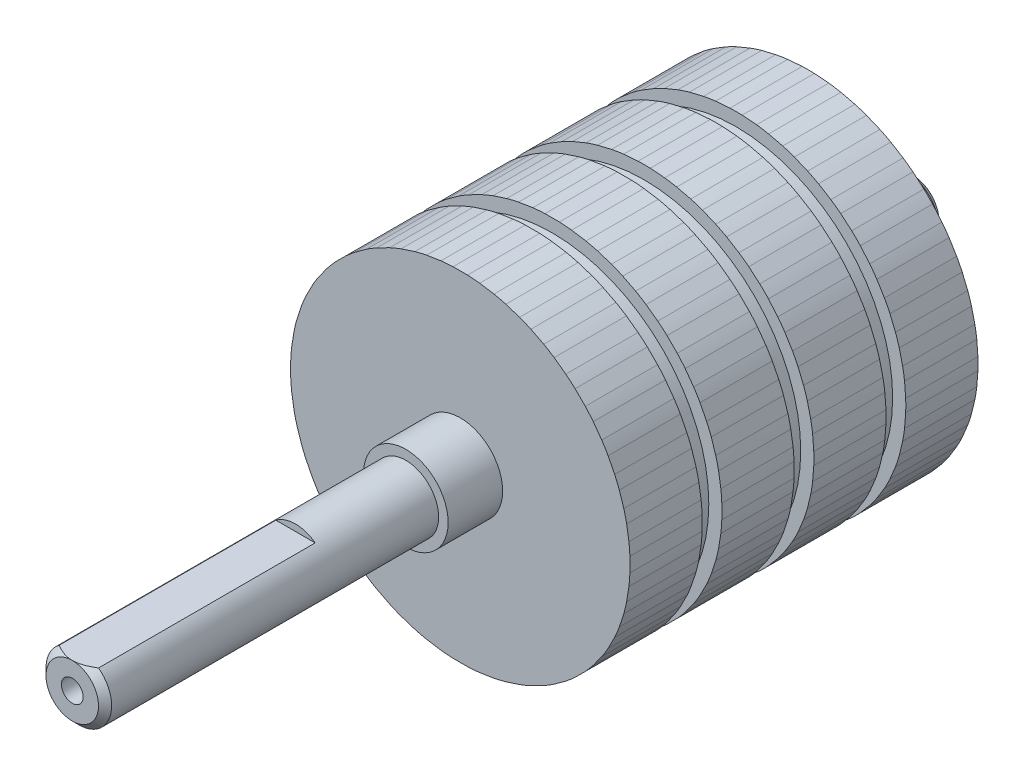
from build123d import *

# Parameters (mm, degrees)
SKETCH2_OUTSIDE_W  = 42.592
SKETCH2_OUTSIDE_H  = 42.592
CUT_EXTRUDE1_DEPTH = 12.5
SKETCH3_OUTSIDE_W  = 42.592
SKETCH3_OUTSIDE_H  = 42.592
CUT_EXTRUDE2_DEPTH = 12.5
SKETCH4_W          = 5
SKETCH4_H          = 1
CUT_EXTRUDE3_DEPTH = 17


with BuildPart() as part:
    # Sketch1 → Revolve1 (revolve)
    with BuildSketch(Plane(origin=(0, 0, 0), x_dir=(0, 0, -1), z_dir=(1, 0, 0)), mode=Mode.PRIVATE) as revolve1_sk:
        Polygon((-26.4, -0.825), (-27.9, -0.825), (-27.9, -2), (-27.4, -2.5), (-2.5, -2.5), (-2.5, -3.225), (1.65, -3.225), (1.65, -12.925), (2.65, -11.925), (6.15, -11.925), (7.15, -12.925), (7.15, -11.925), (8.65, -11.925), (8.65, -12.925), (9.65, -11.925), (13.15, -11.925), (14.15, -12.925), (14.15, -11.925), (15.65, -11.925), (15.65, -12.925), (16.65, -11.925), (20.15, -11.925), (21.15, -12.925), (21.15, -11.925), (22.65, -11.925), (22.65, -12.925), (23.65, -11.925), (27.15, -11.925), (28.15, -12.925), (28.15, -3.225), (31.6, -3.225), (31.6, -2.5), (35.6, -2.5), (36.1, -2), (36.1, -0.875), (34.6, -0.875), (34.6, 0), (-26.4, 0), align=None)
    revolve(revolve1_sk.sketch.rotate(Axis((0, 0, 34.738268814), (0, 0, -1)), 270), axis=Axis((0, 0, 34.738268814), (0, 0, -1)))

    # Sketch1<3> → Revolve2 (revolve)
    with BuildSketch(Plane(origin=(0, 0, 0), x_dir=(0, 0, -1), z_dir=(1, 0, 0)), mode=Mode.PRIVATE) as revolve2_sk:
        Polygon((2.65, -11.925), (1.65, -12.925), (7.15, -12.925), (6.15, -11.925), align=None)
        Polygon((9.65, -11.925), (8.65, -12.925), (14.15, -12.925), (13.15, -11.925), align=None)
        Polygon((22.65, -12.925), (28.15, -12.925), (27.15, -11.925), (23.65, -11.925), align=None)
        Polygon((16.65, -11.925), (15.65, -12.925), (21.15, -12.925), (20.15, -11.925), align=None)
    revolve(revolve2_sk.sketch.rotate(Axis((0, 0, 34.738268814), (0, 0, -1)), 270), axis=Axis((0, 0, 34.738268814), (0, 0, -1)))

    # Sketch2 outside → Cut-Extrude1 (cut)
    with BuildSketch(Plane.XY.offset(-1.65)):
        Rectangle(SKETCH2_OUTSIDE_W, SKETCH2_OUTSIDE_H)
        Polygon((4.956983851, 11.967217641), (3.023869864, 12.59532445), (1.016298166, 12.91329257), (-1.016298166, 12.91329257), (-3.023869864, 12.59532445), (-4.956983851, 11.967217641), (-6.768040444, 11.044438216), (-8.412445419, 9.849708069), (-9.849708069, 8.412445419), (-11.044438216, 6.768040444), (-11.967217641, 4.956983851), (-12.59532445, 3.023869864), (-12.91329257, 1.016298166), (-12.91329257, -1.016298166), (-12.59532445, -3.023869864), (-11.967217641, -4.956983851), (-11.044438216, -6.768040444), (-9.849708069, -8.412445419), (-8.412445419, -9.849708069), (-6.768040444, -11.044438216), (-4.956983851, -11.967217641), (-3.023869864, -12.59532445), (-1.016298166, -12.91329257), (1.016298166, -12.91329257), (3.023869864, -12.59532445), (4.956983851, -11.967217641), (6.768040444, -11.044438216), (8.412445419, -9.849708069), (9.849708069, -8.412445419), (11.044438216, -6.768040444), (11.967217641, -4.956983851), (12.59532445, -3.023869864), (12.91329257, -1.016298166), (12.91329257, 1.016298166), (12.59532445, 3.023869864), (11.967217641, 4.956983851), (11.044438216, 6.768040444), (9.849708069, 8.412445419), (8.412445419, 9.849708069), (6.768040444, 11.044438216), align=None, mode=Mode.SUBTRACT)
    extrude(amount=-CUT_EXTRUDE1_DEPTH, mode=Mode.SUBTRACT)

    # Sketch3 outside → Cut-Extrude2 (cut)
    with BuildSketch(Plane(origin=(0, 0, -28.15), x_dir=(-1, 0, 0), z_dir=(0, 0, -1))):
        Rectangle(SKETCH3_OUTSIDE_W, SKETCH3_OUTSIDE_H)
        Polygon((0, 12.953223034), (-2.026330516, 12.793747364), (-4.002766049, 12.319247173), (-5.880640198, 11.541406232), (-7.613713469, 10.479377566), (-9.159311845, 9.159311845), (-10.479377566, 7.613713469), (-11.541406232, 5.880640198), (-12.319247173, 4.002766049), (-12.793747364, 2.026330516), (-12.953223034, 0), (-12.793747364, -2.026330516), (-12.319247173, -4.002766049), (-11.541406232, -5.880640198), (-10.479377566, -7.613713469), (-9.159311845, -9.159311845), (-7.613713469, -10.479377566), (-5.880640198, -11.541406232), (-4.002766049, -12.319247173), (-2.026330516, -12.793747364), (0, -12.953223034), (2.026330516, -12.793747364), (4.002766049, -12.319247173), (5.880640198, -11.541406232), (7.613713469, -10.479377566), (9.159311845, -9.159311845), (10.479377566, -7.613713469), (11.541406232, -5.880640198), (12.319247173, -4.002766049), (12.793747364, -2.026330516), (12.953223034, 0), (12.793747364, 2.026330516), (12.319247173, 4.002766049), (11.541406232, 5.880640198), (10.479377566, 7.613713469), (9.159311845, 9.159311845), (7.613713469, 10.479377566), (5.880640198, 11.541406232), (4.002766049, 12.319247173), (2.026330516, 12.793747364), align=None, mode=Mode.SUBTRACT)
    extrude(amount=-CUT_EXTRUDE2_DEPTH, mode=Mode.SUBTRACT)

    # Sketch4 → Cut-Extrude3 (cut)
    with BuildSketch(Plane.XY.offset(27.9)):
        with Locations((0, 2.5)):
            Rectangle(SKETCH4_W, SKETCH4_H)
    extrude(amount=-CUT_EXTRUDE3_DEPTH, mode=Mode.SUBTRACT)


solid = part.part
